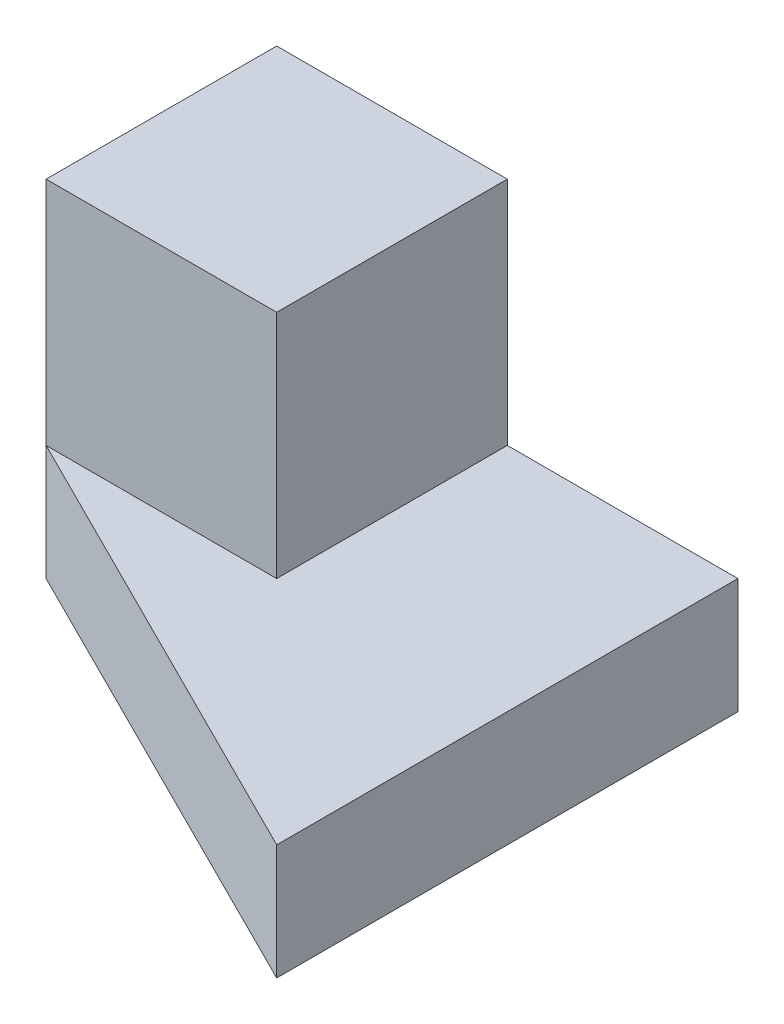
from build123d import *

# Parameters (mm, degrees)
EXTRUDE_4_DEPTH = 10
SKETCH_1_6_W    = 20
SKETCH_1_6_H    = 20
EXTRUDE_5_DEPTH = 20


with BuildPart() as part:
    # 草圖1 → 填料-伸長4 (new body)
    with BuildSketch(Plane(origin=(0, 0, 0), x_dir=(1, 0, 0), z_dir=(0, 1, 0))):
        Polygon((0, 20), (0, 0), (40, -20), (40, 20), align=None)
    extrude(amount=-EXTRUDE_4_DEPTH)

    # 草圖1<6> → 填料-伸長5 (add)
    with BuildSketch(Plane(origin=(0, 0, 0), x_dir=(1, 0, 0), z_dir=(0, 1, 0))):
        with Locations((10, 10)):
            Rectangle(SKETCH_1_6_W, SKETCH_1_6_H)
    extrude(amount=EXTRUDE_5_DEPTH)


solid = part.part
